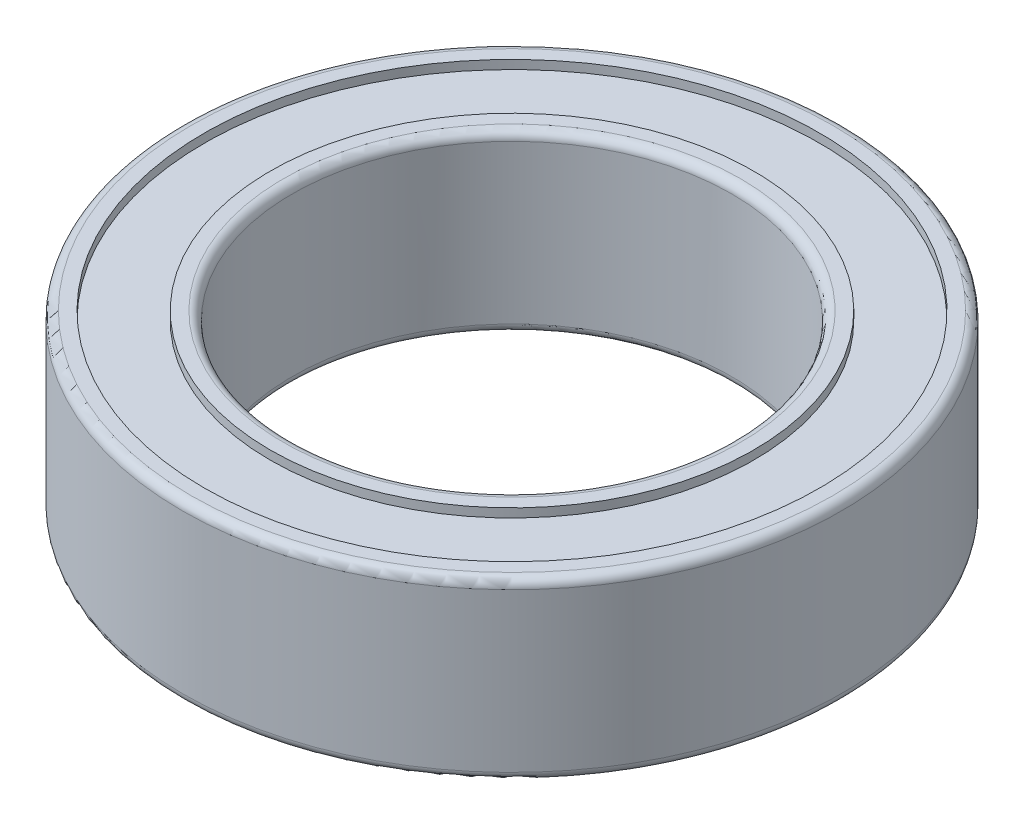
from build123d import *

# Parameters (mm, degrees)
FILLET1_R = 0.2


with BuildPart() as part:
    # Sketch1 → Revolve1 (revolve)
    with BuildSketch(Plane(origin=(0, 0, 0), x_dir=(0, 0, -1), z_dir=(1, 0, 0))):
        Polygon((5, 2), (5, -2), (5.5, -2), (5.5, -1.8), (7, -1.8), (7, -2), (7.5, -2), (7.5, 2), (7, 2), (7, 1.8), (5.5, 1.8), (5.5, 2), align=None)
    revolve(axis=Axis((0, 1.193675889, 0), (0, -1, 0)))

    # Fillet1
    fillet1_edges = [part.edges().sort_by_distance(p)[0] for p in [
        (0, 2, 5),
        (0, -2, 5),
        (0, -2, 7.5),
        (0, 2, 7.5),
    ]]
    fillet(fillet1_edges, radius=FILLET1_R)


solid = part.part
